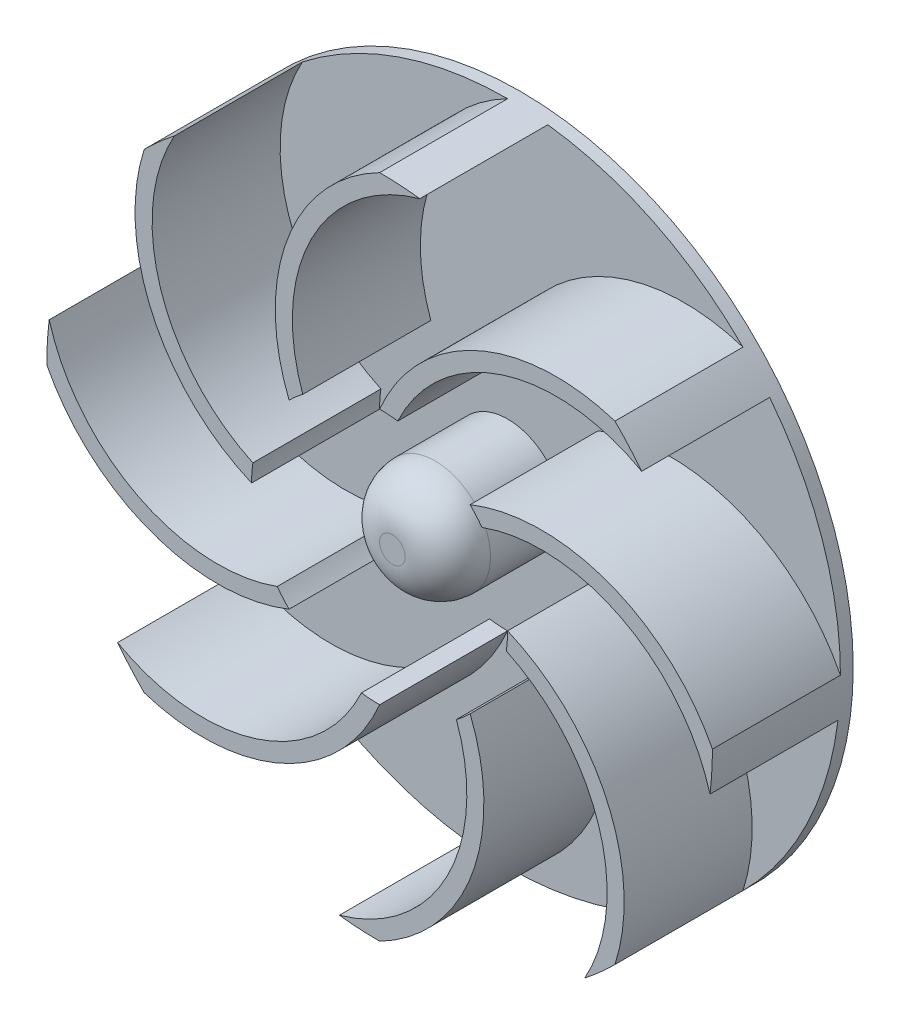
from build123d import *
from build123d.topology import SkipClean

# Parameters (mm, degrees)
BOSS_EXTRUDE1_START = 30
BOSS_EXTRUDE1_DEPTH = 30
CIRPATTERN1_COUNT   = 8
SKETCH3_R           = 8
BOSS_EXTRUDE2_DEPTH = 30


with BuildPart() as part:
    # Sketch1 → Revolve1 (revolve)
    with BuildSketch(Plane(origin=(0, 0, 0), x_dir=(0, 0, -1), z_dir=(1, 0, 0)), mode=Mode.PRIVATE) as revolve1_sk:
        with BuildLine():
            Line((0, 0), (0, 78))
            Line((0, 78), (-3, 78))
            Line((-3, 78), (-3, 13))
            Line((-3, 13), (-20, 13))
            ThreePointArc((-20, 13), (-27.071067812, 10.071067812), (-30, 3))
            Line((-30, 3), (-30, 0))
            Line((-30, 0), (0, 0))
        make_face()
    revolve(revolve1_sk.sketch.rotate(Axis((0, 0, 30), (0, 0, -1)), 90), axis=Axis((0, 0, 30), (0, 0, -1)))

    # Sketch2 → Boss-Extrude1 (add)
    with BuildSketch(Plane.XY.offset(3).offset(BOSS_EXTRUDE1_START)):
        with BuildLine():
            ThreePointArc((-21.213203436, 21.213203436), (-19.654544502, 22.664926217), (-17.996806645, 24.002394684))
            ThreePointArc((-17.996806645, 24.002394684), (-15.924246169, 56.688991773), (9.42496759, 77.42848304))
            ThreePointArc((9.42496759, 77.42848304), (4.721139844, 77.856989658), (0, 78))
            ThreePointArc((0, 78), (-21.603078805, 53.7144317), (-21.213203436, 21.213203436))
        make_face()
    boss_extrude1 = extrude(amount=-BOSS_EXTRUDE1_DEPTH)

    # CirPattern1: Boss-Extrude1 ×8 about axis
    with SkipClean():  # the faces are left unmerged after this step: merging them gives an invalid solid
        cirpattern1_axis = Axis((0, 0, 0), (0, 0, 1))
        for i in range(1, CIRPATTERN1_COUNT):
            add(boss_extrude1.rotate(cirpattern1_axis, i * 360 / CIRPATTERN1_COUNT))

    # Sketch3 → Boss-Extrude2 (add)
    with SkipClean():  # the faces are left unmerged after this step: merging them gives an invalid solid
        with BuildSketch(Plane(origin=(0, 0, 0), x_dir=(-1, 0, 0), z_dir=(0, 0, -1))):
            with Locations(Location((0, 0, 0), (0, 0, 180))):
                Circle(SKETCH3_R)
        extrude(amount=BOSS_EXTRUDE2_DEPTH)


solid = part.part
